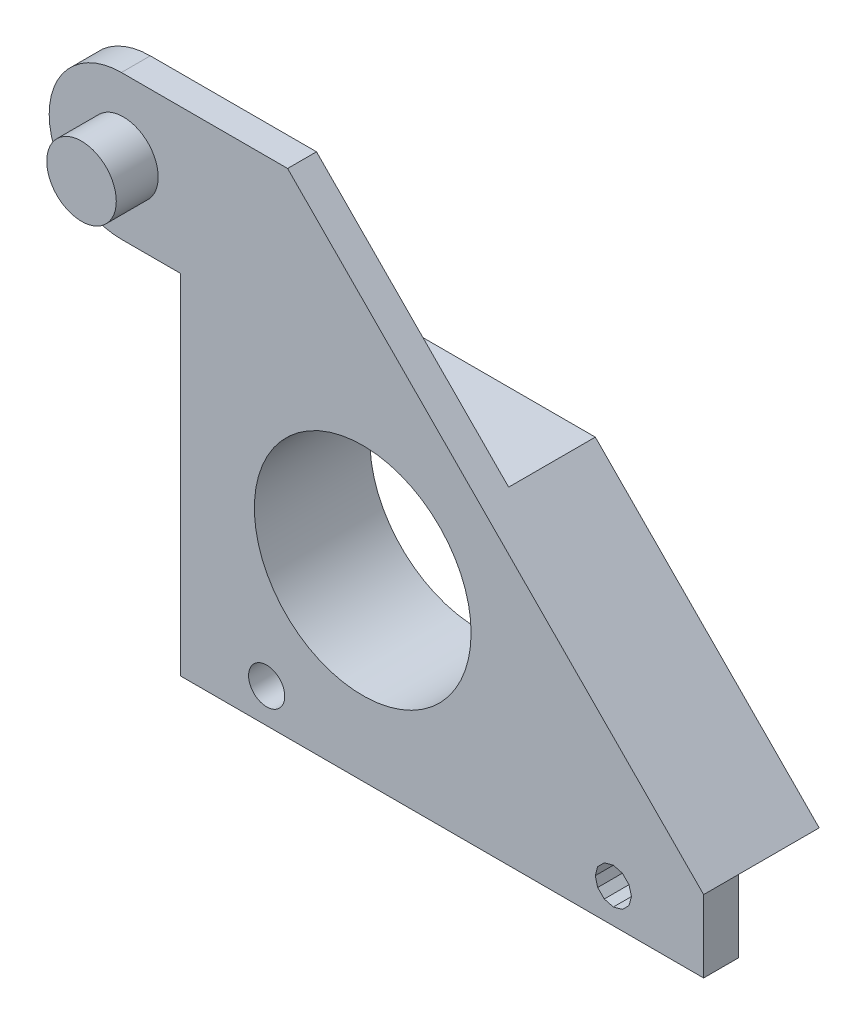
from build123d import *

# Parameters (mm, degrees)
BOSS_EXTRU_1_DEPTH      = 2.400000114
ESQUISSE9_W             = 36.19999811
ESQUISSE9_H             = 2.400000114
BOSS_EXTRU_2_DEPTH      = 5
ESQUISSE14_R            = 7.502289609
ENL_V_MAT_EXTRU_1_DEPTH = 72.750046163
ENL_V_MAT_EXTRU_2_DEPTH = 72.750046163
ESQUISSE25_R            = 1.252758793
ENL_V_MAT_EXTRU_3_DEPTH = 72.750046163
ESQUISSE28_R            = 2.406964412
BOSS_EXTRU_3_DEPTH      = 2.9
SKETCH1_R               = 7.502289609
BOSS_EXTRUDE1_DEPTH     = 8
CUT_EXTRUDE2_START      = -6
CUT_EXTRUDE2_DEPTH      = 6


with BuildPart() as part:
    # Esquisse4 → Boss.-Extru.1 (new body)
    with BuildSketch(Plane.XY.offset(2.400000114)):
        with BuildLine():
            Line((-20.100001246, -24.634756148), (-48.900358379, 4.499999806))
            Line((-48.900358379, 4.499999806), (-60.405611992, 4.499999806))
            ThreePointArc((-60.405611992, 4.499999806), (-65.300002694, -0.500000082), (-60.405611992, -5.49999997))
            Line((-60.405611992, -5.49999997), (-56.299999356, -5.49999997))
            Line((-56.299999356, -5.49999997), (-56.299999356, -24.634756148))
            Line((-56.299999356, -24.634756148), (-20.100001246, -24.634756148))
        make_face()
    extrude(amount=-BOSS_EXTRU_1_DEPTH)

    # Esquisse9 → Boss.-Extru.2 (add)
    with BuildSketch(Plane(origin=(0, -24.634756148, 0), x_dir=(-1, 0, 0), z_dir=(0, -1, 0))):
        with Locations((38.200000301, -1.200000057)):
            Rectangle(ESQUISSE9_W, ESQUISSE9_H)
    extrude(amount=BOSS_EXTRU_2_DEPTH)

    # Esquisse14 → Enlèv. mat.-Extru.1 (cut, through all)
    with BuildSketch(Plane.XY.offset(2.400000114)):
        with Locations((-43.700002134, -16.999939794)):
            Circle(ESQUISSE14_R)
    extrude(amount=-ENL_V_MAT_EXTRU_1_DEPTH, mode=Mode.SUBTRACT)

    # Esquisse19 → Enlèv. mat.-Extru.2 (cut, through all)
    with BuildSketch(Plane.XY.offset(2.400000114)):
        Polygon((-26.350000873, -28.503000736), (-25.724001229, -28.334999457), (-25.264998898, -27.875998989), (-25.096999481, -27.249999344), (-25.264998898, -26.6239997), (-25.724001229, -26.165001094), (-26.350000873, -25.998000056), (-26.976000518, -26.165001094), (-27.434999123, -26.6239997), (-27.602000162, -27.249999344), (-27.434999123, -27.875998989), (-26.976000518, -28.334999457), align=None)
    extrude(amount=-ENL_V_MAT_EXTRU_2_DEPTH, mode=Mode.SUBTRACT)

    # Esquisse25 → Enlèv. mat.-Extru.3 (cut, through all)
    with BuildSketch(Plane(origin=(0, 0, 0), x_dir=(-1, 0, 0), z_dir=(0, 0, -1))):
        with Locations((50.350001082, -27.250241944)):
            Circle(ESQUISSE25_R)
    extrude(amount=-ENL_V_MAT_EXTRU_3_DEPTH, mode=Mode.SUBTRACT)

    # Esquisse28 → Boss.-Extru.3 (add)
    with BuildSketch(Plane.XY.offset(2.400000114)):
        with Locations((-60.267728087, -0.4991006)):
            Circle(ESQUISSE28_R)
    extrude(amount=BOSS_EXTRU_3_DEPTH)

    # Sketch1 → Boss-Extrude1 (add)
    with BuildSketch(Plane.XY.offset(2.400000114)):
        with BuildLine():
            Line((-56.299999356, -24.634756148), (-56.299999356, -5.49999997))
            Line((-56.299999356, -5.49999997), (-60.405611992, -5.49999997))
            ThreePointArc((-60.405611992, -5.49999997), (-65.40561188, -0.500000082), (-60.405611992, 4.499999806))
            Line((-60.405611992, 4.499999806), (-48.900358379, 4.499999806))
            Line((-48.900358379, 4.499999806), (-20.100001246, -24.634756148))
            Line((-20.100001246, -24.634756148), (-56.299999356, -24.634756148))
        make_face()
        with Locations((-43.700002134, -16.999939794)):
            Circle(SKETCH1_R, mode=Mode.SUBTRACT)
    extrude(amount=-BOSS_EXTRUDE1_DEPTH)

    # Sketch3 → Cut-Extrude2 (cut)
    with BuildSketch(Plane(origin=(0, 0, -5.599999886), x_dir=(-1, 0, 0), z_dir=(0, 0, -1)).offset(CUT_EXTRUDE2_START)):
        with BuildLine():
            Line((56.299999356, -8.9560628), (56.299999356, -5.49999997))
            Line((56.299999356, -5.49999997), (60.405611992, -5.49999997))
            ThreePointArc((60.405611992, -5.49999997), (65.40561188, -0.500000082), (60.405611992, 4.499999806))
            Line((60.405611992, 4.499999806), (48.900358379, 4.499999806))
            Line((48.900358379, 4.499999806), (35.598739883, -8.9560628))
            Line((35.598739883, -8.9560628), (56.299999356, -8.9560628))
        make_face()
    extrude(amount=CUT_EXTRUDE2_DEPTH, mode=Mode.SUBTRACT)


solid = part.part
